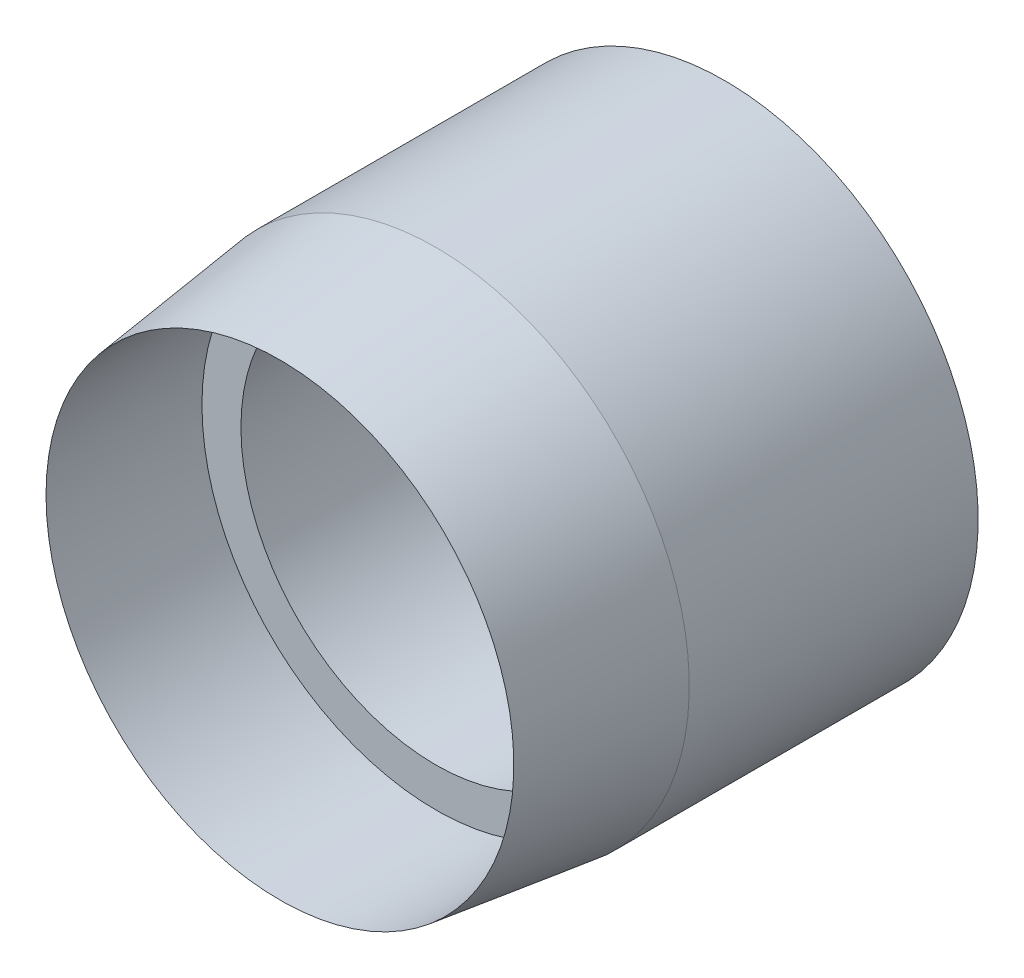
from build123d import *


with BuildPart() as part:
    # Sketch1 → Revolve1 (revolve)
    with BuildSketch(Plane.YZ, mode=Mode.PRIVATE) as revolve1_sk:
        Polygon((-63.5, 0), (-82.55, 0), (-82.55, 94.108607595), (-76.2, 144.908607595), (-76.2, 94.108607595), (-63.5, 94.108607595), align=None)
    revolve(revolve1_sk.sketch.rotate(Axis((0, 0, 0), (0, 0, 1)), 270), axis=Axis((0, 0, 0), (0, 0, 1)))


solid = part.part
